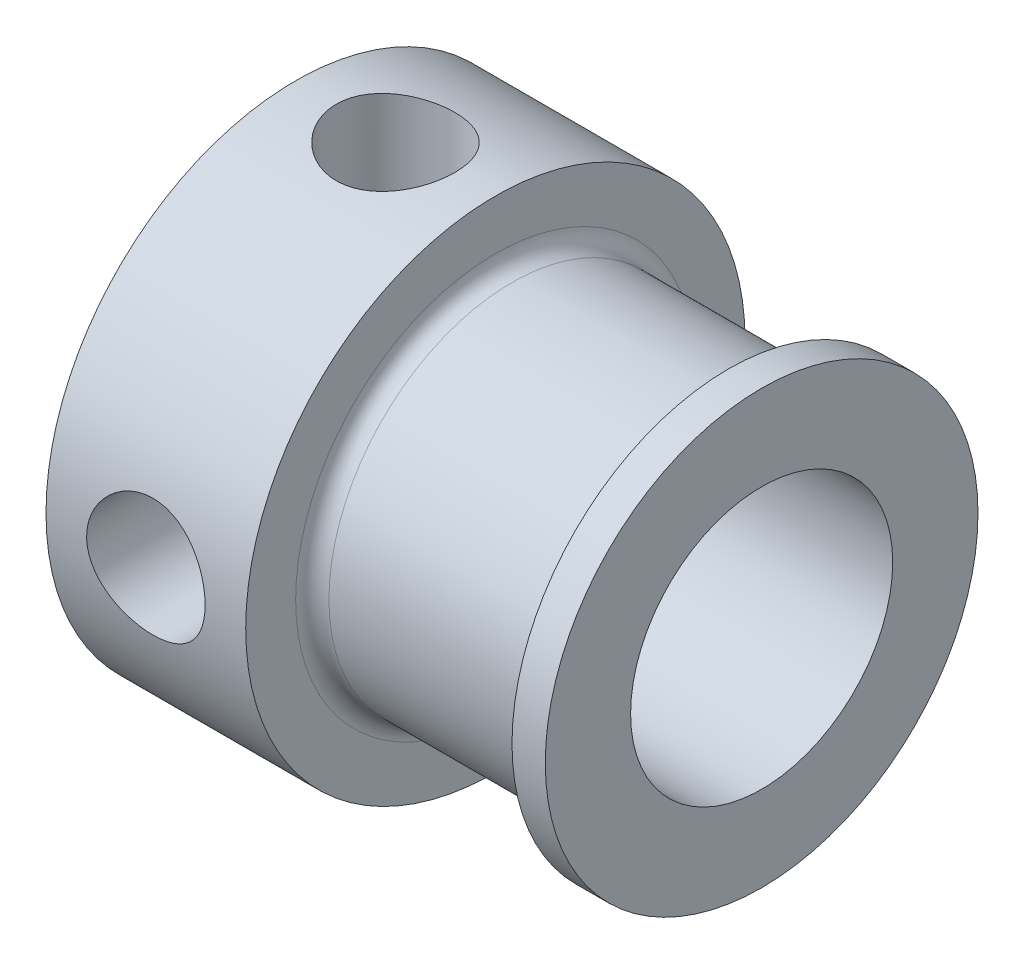
from build123d import *

# Parameters (mm, degrees)
SKETCH1_R            = 4.7625
SKETCH1_R_2          = 2.499995
BASE_DEPTH           = 8.89
CRIMPHOLE_DEPTH      = 12.153246725
CRIMPHOLE_DEPTH_BACK = 12.153246725
SKETCH7_R            = 0.396875
SKETCH3_W            = 1.1303
SKETCH3_H            = 4.7635
CUTTERRAD_R          = 0.3175
CIRPATTERN1_COUNT    = 4


with BuildPart() as part:
    # Sketch1 → Base (new body)
    with BuildSketch(Plane(origin=(0, 0, 0), x_dir=(0, 0, -1), z_dir=(1, 0, 0))):
        Circle(SKETCH1_R)
        Circle(SKETCH1_R_2, mode=Mode.SUBTRACT)
    extrude(amount=BASE_DEPTH)

    # Sketch2 → Spool (revolve, cut)
    with BuildSketch(Plane.XY, mode=Mode.PRIVATE) as spool_sk:
        Polygon((3.81, 4.7625), (8.89, 4.7625), (8.89, 4.1275), (8.255, 4.1275), (8.255, 3.4925), (3.81, 3.4925), align=None)
    revolve(spool_sk.sketch.rotate(Axis((8.89, 0, 0), (-1, 0, 0)), 90), axis=Axis((8.89, 0, 0), (-1, 0, 0)), mode=Mode.SUBTRACT)

    # Sketch7 → CrimpHole (cut, two sides: drawn at the far end of the back side and taken through both)
    with BuildSketch(Plane(origin=(0, 0, 0), x_dir=(1, 0, 0), z_dir=(0, 1, 0)).offset(-CRIMPHOLE_DEPTH_BACK)):
        with Locations(Location((1.905, 3.81, 0), (0, 0, 270))):
            Circle(SKETCH7_R)
    extrude(amount=CRIMPHOLE_DEPTH + CRIMPHOLE_DEPTH_BACK, mode=Mode.SUBTRACT)

    # Sketch3 → ShaftSetScrew (revolve, cut)
    with BuildSketch(Plane.YZ.offset(1.905)):
        with Locations((0.56515, 2.38175)):
            Rectangle(SKETCH3_W, SKETCH3_H)
    shaftsetscrew = revolve(axis=Axis((1.905, 0, -6.35), (0, 0, 1)), mode=Mode.SUBTRACT)

    # CutterRad
    cutterrad_edges = [part.edges().sort_by_distance(p)[0] for p in [
        (3.81, 0, 3.4925),
        (8.255, 0, 3.4925),
    ]]
    fillet(cutterrad_edges, radius=CUTTERRAD_R)

    # CirPattern1: ShaftSetScrew ×4 about axis, 1 skipped
    cirpattern1_axis = Axis((8.89, 0, 0), (-1, 0, 0))
    add([shaftsetscrew.rotate(cirpattern1_axis, i * 360 / CIRPATTERN1_COUNT) for i in range(1, CIRPATTERN1_COUNT) if i not in (2,)], mode=Mode.SUBTRACT)


solid = part.part
